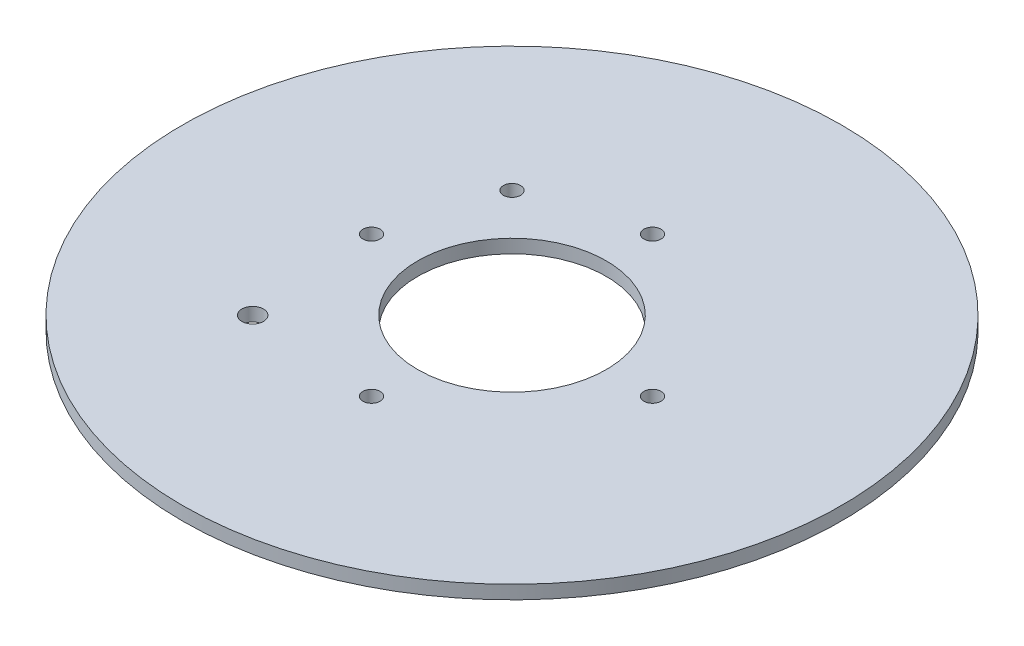
from build123d import *

# Parameters (mm, degrees)
SKETCH1_R           = 77.4600051
BOSS_EXTRUDE1_DEPTH = 3.175
SKETCH24_R          = 22.1615
SKETCH24_R_2        = 2.54
SKETCH24_R_3        = 2.0193
CUT_EXTRUDE14_DEPTH = 110.590991442


with BuildPart() as part:
    # Sketch1 → Boss-Extrude1 (new body)
    with BuildSketch(Plane(origin=(0, 0, 0), x_dir=(1, 0, 0), z_dir=(0, 1, 0))):
        with Locations(Location((0, 0, 0), (0, 0, 270))):
            Circle(SKETCH1_R)
    extrude(amount=BOSS_EXTRUDE1_DEPTH)

    # Sketch24 → Cut-Extrude14 (cut, through all)
    with BuildSketch(Plane(origin=(0, 3.175, 0), x_dir=(1, 0, 0), z_dir=(0, 1, 0))):
        with Locations(Location((0, 0, 0), (0, 0, 270))):
            Circle(SKETCH24_R)
        with Locations(Location((-30.48, -30.48, 0), (0, 0, 270))):
            Circle(SKETCH24_R_2)
        with Locations(Location((0, -33.02, 0), (0, 0, 270))):
            Circle(SKETCH24_R_3)
        with Locations(Location((33.02, 0, 0), (0, 0, 270))):
            Circle(SKETCH24_R_3)
        with Locations(Location((0, 33.02, 0), (0, 0, 270))):
            Circle(SKETCH24_R_3)
        with Locations(Location((-33.02, 0, 0), (0, 0, 270))):
            Circle(SKETCH24_R_3)
        with Locations(Location((-25.4, 25.4, 0), (0, 0, 270))):
            Circle(SKETCH24_R_3)
    extrude(amount=-CUT_EXTRUDE14_DEPTH, mode=Mode.SUBTRACT)


solid = part.part
